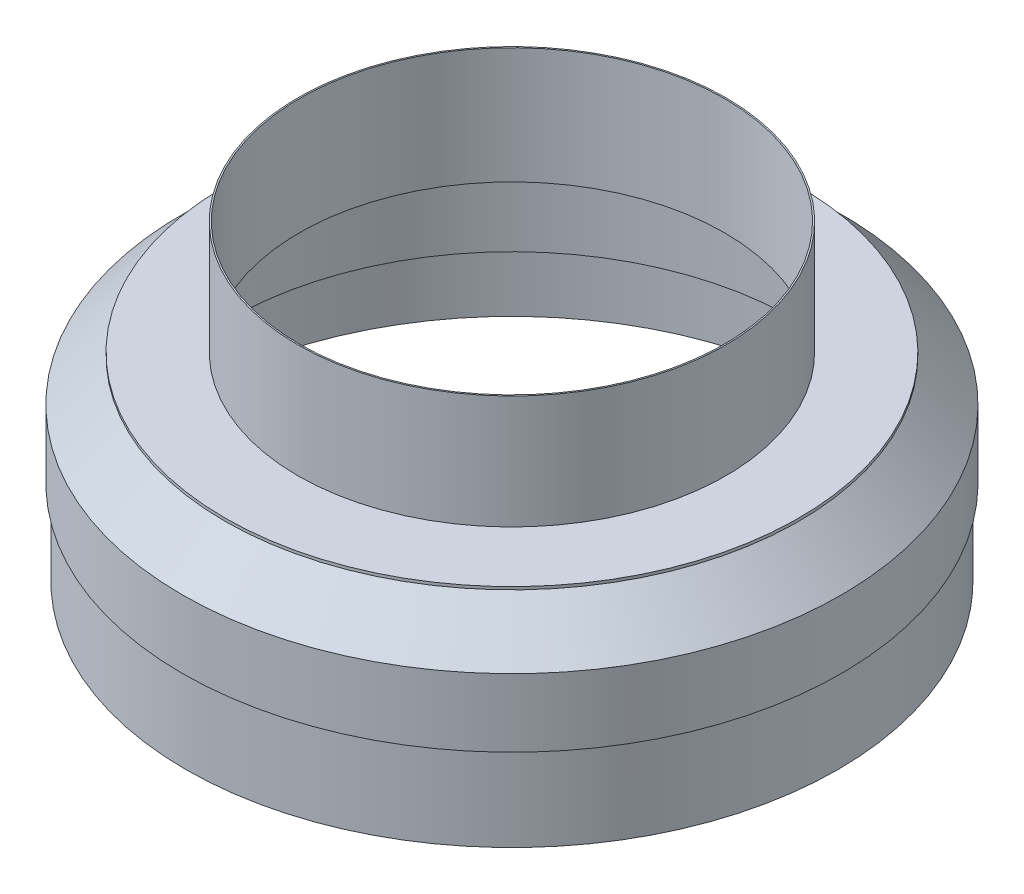
from build123d import *

# Parameters (mm, degrees)
SKETCH_1_R        = 232.5
SKETCH_1_R_2      = 200
EXTRUDE_1_DEPTH   = 78
SKETCH_2_R        = 151
SKETCH_2_R_2      = 150
EXTRUDE_2_DEPTH   = 82
CHAMFER_1_SIZE    = 30
SKETCH_4_R        = 202.5
SKETCH_4_R_2      = 150
EXTRUDE_1_2_DEPTH = 2
SKETCH_5_R        = 230
SKETCH_5_R_2      = 229
EXTRUDE_2_2_DEPTH = 60


with BuildPart() as part:
    # Эскиз1 → Extrude 1 (new body)
    with BuildSketch(Plane(origin=(0, 0, 0), x_dir=(1, 0, 0), z_dir=(0, 1, 0))):
        with Locations(Location((0, 0, 0), (0, 0, 270))):
            Circle(SKETCH_1_R)
        with Locations(Location((0, 0, 0), (0, 0, 270))):
            Circle(SKETCH_1_R_2, mode=Mode.SUBTRACT)
    extrude(amount=EXTRUDE_1_DEPTH)

    # Фаска1
    chamfer_1_edges = [part.edges().sort_by_distance(p)[0] for p in [
        (0, 78, -232.5),
    ]]
    chamfer(chamfer_1_edges, length=CHAMFER_1_SIZE)



with BuildPart() as body_2:
    # Эскиз2 → Extrude 2 (new body)
    with BuildSketch(Plane(origin=(0, 78, 0), x_dir=(1, 0, 0), z_dir=(0, 1, 0))):
        with Locations(Location((0, 0, 0), (0, 0, 270))):
            Circle(SKETCH_2_R)
        with Locations(Location((0, 0, 0), (0, 0, 270))):
            Circle(SKETCH_2_R_2, mode=Mode.SUBTRACT)
    extrude(amount=EXTRUDE_2_DEPTH)


with BuildPart() as part_1:
    add(part.part)

    add(body_2.part)  # Extrude 1 2 merges body 2
    # Эскиз4 → Extrude 1 2 (add)
    with BuildSketch(Plane(origin=(0, 78, 0), x_dir=(1, 0, 0), z_dir=(0, 1, 0))):
        with Locations(Location((0, 0, 0), (0, 0, 270))):
            Circle(SKETCH_4_R)
        with Locations(Location((0, 0, 0), (0, 0, 270))):
            Circle(SKETCH_4_R_2, mode=Mode.SUBTRACT)
    extrude(amount=EXTRUDE_1_2_DEPTH)

    # Эскиз5 → Extrude 2 2 (add)
    with BuildSketch(Plane.XZ):
        with Locations(Location((0, 0, 0), (0, 0, 90))):
            Circle(SKETCH_5_R)
        with Locations(Location((0, 0, 0), (0, 0, 270))):
            Circle(SKETCH_5_R_2, mode=Mode.SUBTRACT)
    extrude(amount=EXTRUDE_2_2_DEPTH)


solid = part_1.part
